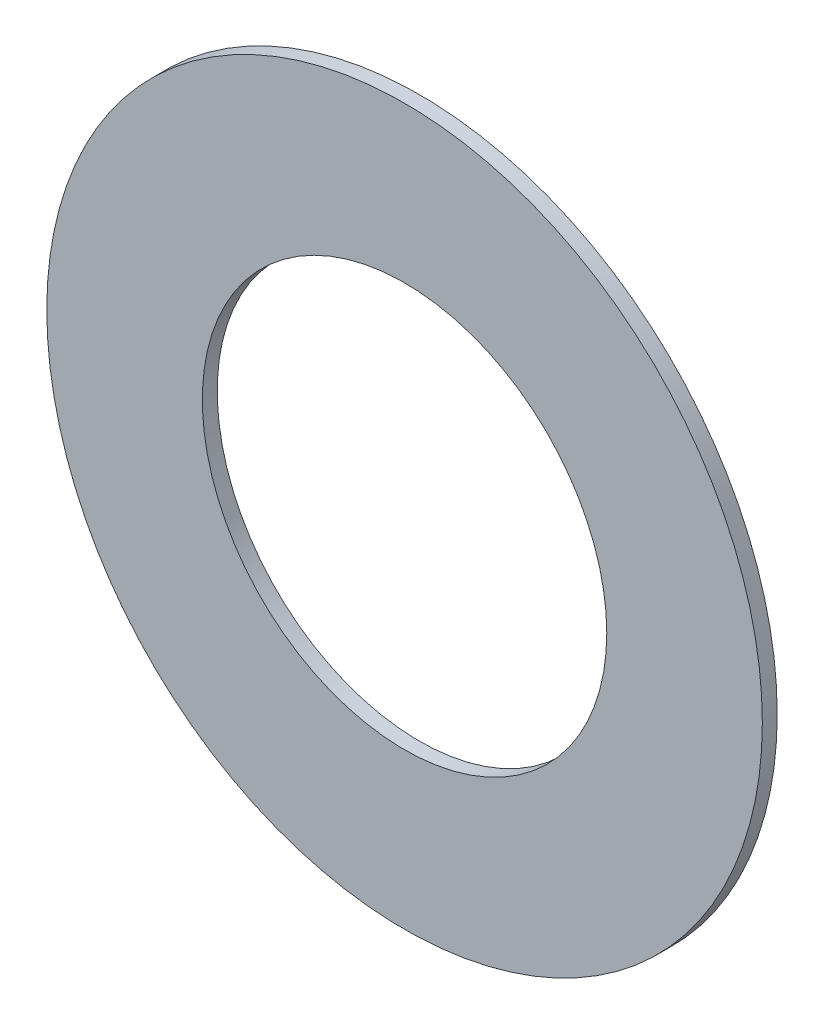
from build123d import *

# Parameters (mm, degrees)
SKETCH1_R           = 36.5125
SKETCH1_R_2         = 20.6375
BOSS_EXTRUDE1_DEPTH = 1.51892


with BuildPart() as part:
    # Sketch1 → Boss-Extrude1 (new body)
    with BuildSketch(Plane.XY):
        Circle(SKETCH1_R)
        Circle(SKETCH1_R_2, mode=Mode.SUBTRACT)
    extrude(amount=BOSS_EXTRUDE1_DEPTH)


solid = part.part
